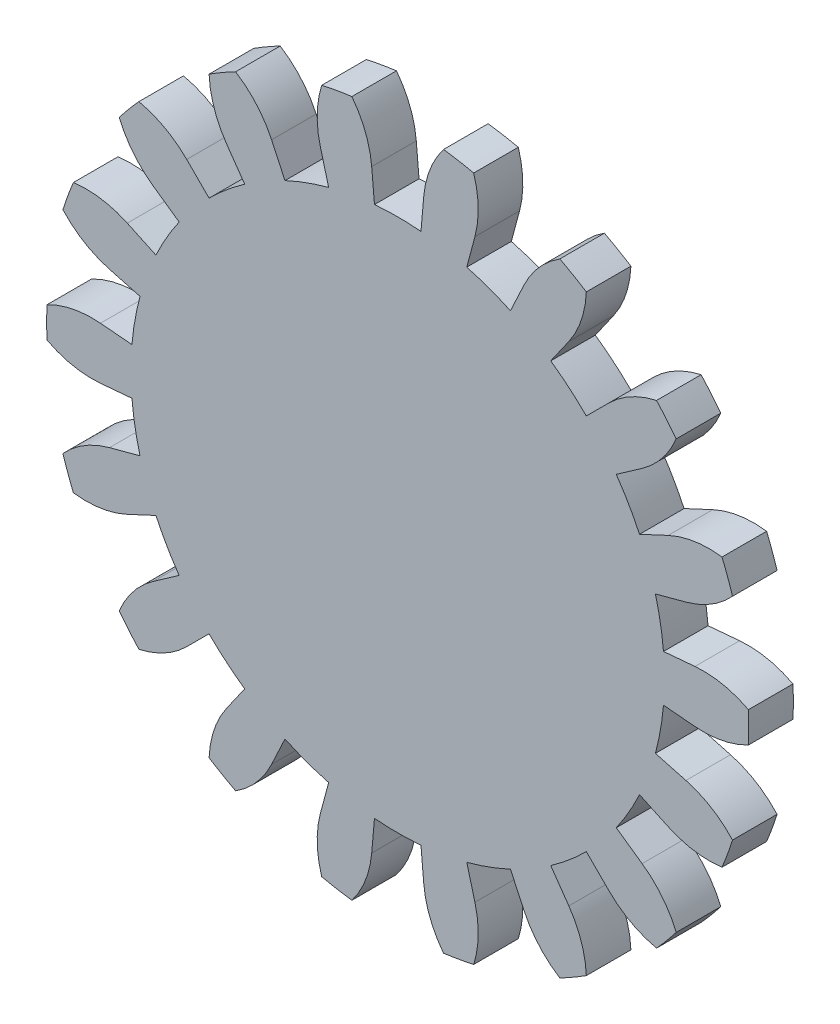
from build123d import *

# Parameters (mm, degrees)
BOSS_EXTRUDE2_DEPTH = 6.35
CIRPATTERN1_COUNT   = 18


with BuildPart() as part:
    # Sketch4 → Boss-Extrude2 (new body)
    with BuildSketch(Plane.XY):
        with BuildLine():
            Line((42.338274669, 3.704119067), (37.855398527, 3.311918224))
            ThreePointArc((37.855398527, 3.311918224), (37.674904732, 4.959995304), (37.422694614, 6.598630751))
            Line((37.422694614, 6.598630751), (0, 0))
            Line((0, 0), (37.422694614, -6.598630751))
            ThreePointArc((37.422694614, -6.598630751), (37.674904732, -4.959995304), (37.855398527, -3.311918224))
            Line((37.855398527, -3.311918224), (42.338274669, -3.704119067))
            ThreePointArc((42.338274669, -3.704119067), (46.254492359, -3.488176122), (49.952411079, -2.180969368))
            ThreePointArc((49.952411079, -2.180969368), (50, 0), (49.952411079, 2.180969368))
            ThreePointArc((49.952411079, 2.180969368), (46.254492359, 3.488176122), (42.338274669, 3.704119067))
        make_face()
    boss_extrude2 = extrude(amount=BOSS_EXTRUDE2_DEPTH)

    # CirPattern1: Boss-Extrude2 ×18 about axis
    cirpattern1_axis = Axis((0, 0, 0), (0, 0, 1))
    for i in range(1, CIRPATTERN1_COUNT):
        add(boss_extrude2.rotate(cirpattern1_axis, i * 360 / CIRPATTERN1_COUNT))


solid = part.part
